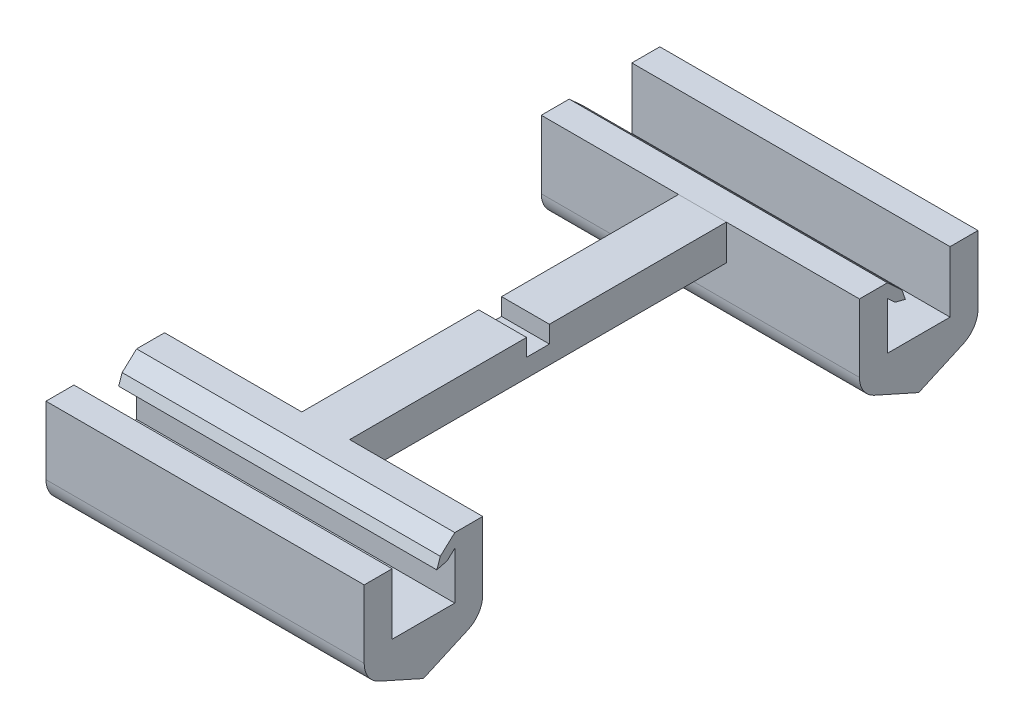
from build123d import *

# Parameters (mm, degrees)
BOSS_EXTRUDE1_DEPTH   = 12.7
BOSS_EXTRUDE1_2_DEPTH = 12.7
BOSS_EXTRUDE2_REACH   = 25.952
SKETCH3_W             = 0.912
SKETCH3_H             = 0.685354174
CUT_EXTRUDE1_DEPTH    = 1.90971


with BuildPart() as part:
    # Sketch1 → Boss-Extrude1 (new body)
    with BuildSketch(Plane(origin=(0, 0, 0), x_dir=(0, 0, -1), z_dir=(1, 0, 0))):
        with BuildLine():
            Line((8.940018824, -1.056929722), (8.633907374, -0.775336999))
            Line((8.633907374, -0.775336999), (8.633907374, -2.669252732))
            Line((8.633907374, -2.669252732), (11.133907374, -2.669252732))
            Line((11.133907374, -2.669252732), (11.133907374, -0.231834165))
            Line((11.133907374, -0.231834165), (12.249761705, -0.231834165))
            Line((12.249761705, -0.231834165), (12.249761705, -2.945307351))
            ThreePointArc((12.249761705, -2.945307351), (12.088994801, -3.489079188), (11.658386083, -3.858009996))
            Line((11.658386083, -3.858009996), (9.883907374, -4.652458509))
            Line((9.883907374, -4.652458509), (8.109428664, -3.858009996))
            ThreePointArc((8.109428664, -3.858009996), (7.678819947, -3.489079188), (7.518053042, -2.945307351))
            Line((7.518053042, -2.945307351), (7.518053042, -0.231834165))
            Line((7.518053042, -0.231834165), (8.633907374, -0.231834165))
            Line((8.633907374, -0.231834165), (9.210825909, -0.762543032))
            Line((9.210825909, -0.762543032), (9.350955392, -1.163199927))
            Line((9.350955392, -1.163199927), (8.940018824, -1.056929722))
        make_face()
    extrude(amount=BOSS_EXTRUDE1_DEPTH)


with BuildPart() as body_2:
    # Sketch1 → Boss-Extrude1 2 (new body)
    with BuildSketch(Plane(origin=(0, 0, 0), x_dir=(0, 0, -1), z_dir=(1, 0, 0))):
        with BuildLine():
            Line((-8.633907374, -0.231834165), (-7.518053042, -0.231834165))
            Line((-7.518053042, -0.231834165), (-7.518053042, -2.945307351))
            ThreePointArc((-7.518053042, -2.945307351), (-7.678819947, -3.489079188), (-8.109428664, -3.858009996))
            Line((-8.109428664, -3.858009996), (-9.883907374, -4.652458509))
            Line((-9.883907374, -4.652458509), (-11.658386083, -3.858009996))
            ThreePointArc((-11.658386083, -3.858009996), (-12.088994801, -3.489079188), (-12.249761705, -2.945307351))
            Line((-12.249761705, -2.945307351), (-12.249761705, -0.231834165))
            Line((-12.249761705, -0.231834165), (-11.133907374, -0.231834165))
            Line((-11.133907374, -0.231834165), (-11.133907374, -2.669252732))
            Line((-11.133907374, -2.669252732), (-8.633907374, -2.669252732))
            Line((-8.633907374, -2.669252732), (-8.633907374, -0.775336999))
            Line((-8.633907374, -0.775336999), (-8.940018824, -1.056929722))
            Line((-8.940018824, -1.056929722), (-9.350955392, -1.163199927))
            Line((-9.350955392, -1.163199927), (-9.210825909, -0.762543032))
            Line((-9.210825909, -0.762543032), (-8.633907374, -0.231834165))
        make_face()
    extrude(amount=BOSS_EXTRUDE1_2_DEPTH)

    # Sketch2 → Boss-Extrude2 (add, up to next)
    with BuildSketch(Plane.XY.offset(-7.518053042), mode=Mode.PRIVATE) as boss_extrude2_sk1:
        Polygon((5.47811731, -0.231834165), (7.387826905, -0.231834165), (7.387826905, -1.641579788), (6.432972108, -2.596434586), (5.47811731, -1.641579788), align=None)
    boss_extrude2_tool1 = extrude(boss_extrude2_sk1.sketch, amount=BOSS_EXTRUDE2_REACH, mode=Mode.PRIVATE) - body_2.part
    add(boss_extrude2_tool1.solids().sort_by_distance((6.432972, -1.195551, -7.518053))[0])

    # Sketch3 → Cut-Extrude1 (cut)
    with BuildSketch(Plane.ZY.offset(-5.47811731)):
        with Locations((0, -0.574511252)):
            Rectangle(SKETCH3_W, SKETCH3_H)
    extrude(amount=-CUT_EXTRUDE1_DEPTH, mode=Mode.SUBTRACT)


solid = Compound([part.part, body_2.part])
